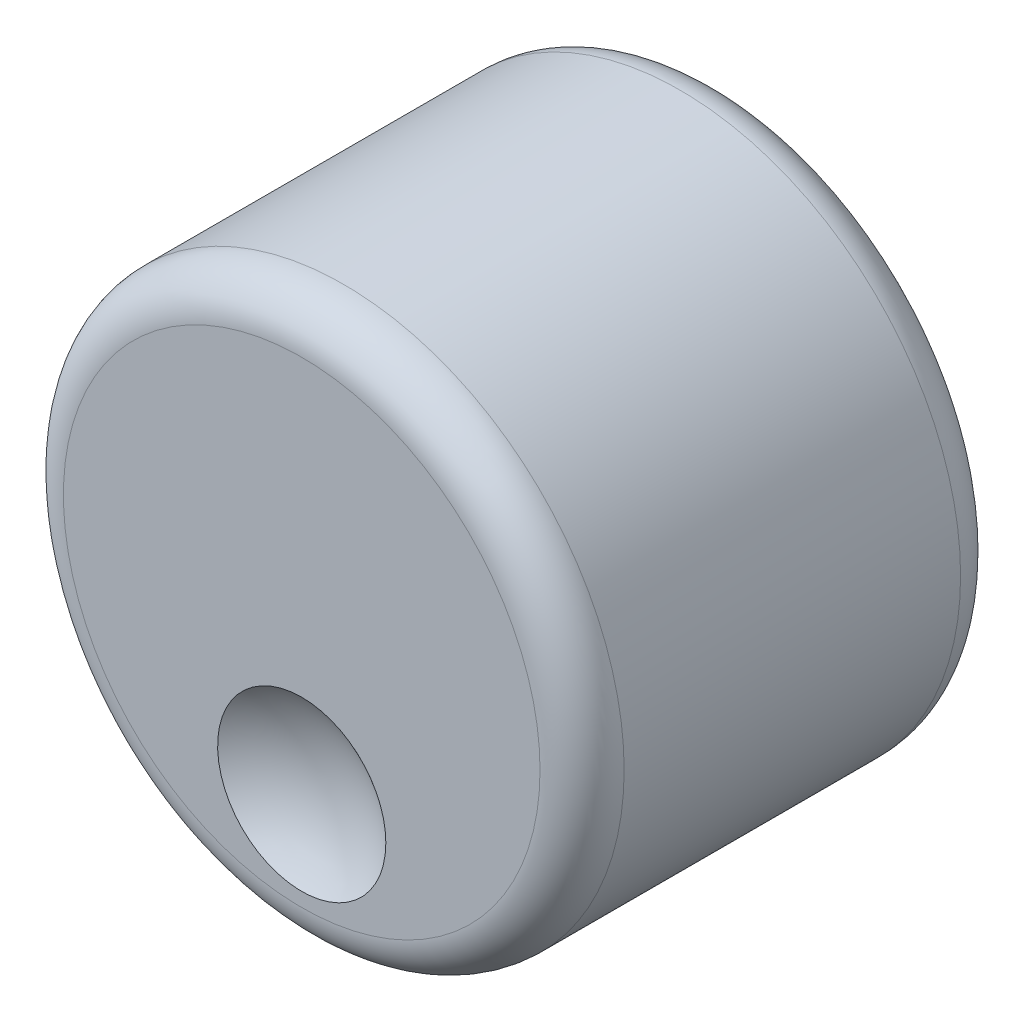
from build123d import *

# Parameters (mm, degrees)
SKETCH1_R           = 10
BOSS_EXTRUDE1_DEPTH = 15
FILLET1_R           = 1.5
SKETCH2_R           = 3
CUT_EXTRUDE1_DEPTH  = 12
CHAMFER1_SIZE       = 1


with BuildPart() as part:
    # Sketch1 → Boss-Extrude1 (new body)
    with BuildSketch(Plane.XY):
        Circle(SKETCH1_R)
    extrude(amount=BOSS_EXTRUDE1_DEPTH)

    # Fillet1
    fillet1_edges = [part.edges().sort_by_distance(p)[0] for p in [
        (-10, 0, 0),
        (-10, 0, 15),
    ]]
    fillet(fillet1_edges, radius=FILLET1_R)

    # Sketch2 → Cut-Extrude1 (cut)
    with BuildSketch(Plane(origin=(0, 0, 0), x_dir=(-1, 0, 0), z_dir=(0, 0, -1))):
        Circle(SKETCH2_R)
    extrude(amount=-CUT_EXTRUDE1_DEPTH, mode=Mode.SUBTRACT)

    # Chamfer1
    chamfer1_edges = [part.edges().sort_by_distance(p)[0] for p in [
        (3, 0, 0),
    ]]
    chamfer(chamfer1_edges, length=CHAMFER1_SIZE)

    # Sketch3 → Cut-Revolve2 (revolve, cut)
    with BuildSketch(Plane(origin=(0, 0, 0), x_dir=(0, 0, -1), z_dir=(1, 0, 0))):
        with BuildLine():
            Line((-24, -5), (-14, -5))
            ThreePointArc((-14, -5), (-19, -10), (-24, -5))
        make_face()
    revolve(axis=Axis((0, -5, 24), (0, 0, -1)), mode=Mode.SUBTRACT)


solid = part.part
